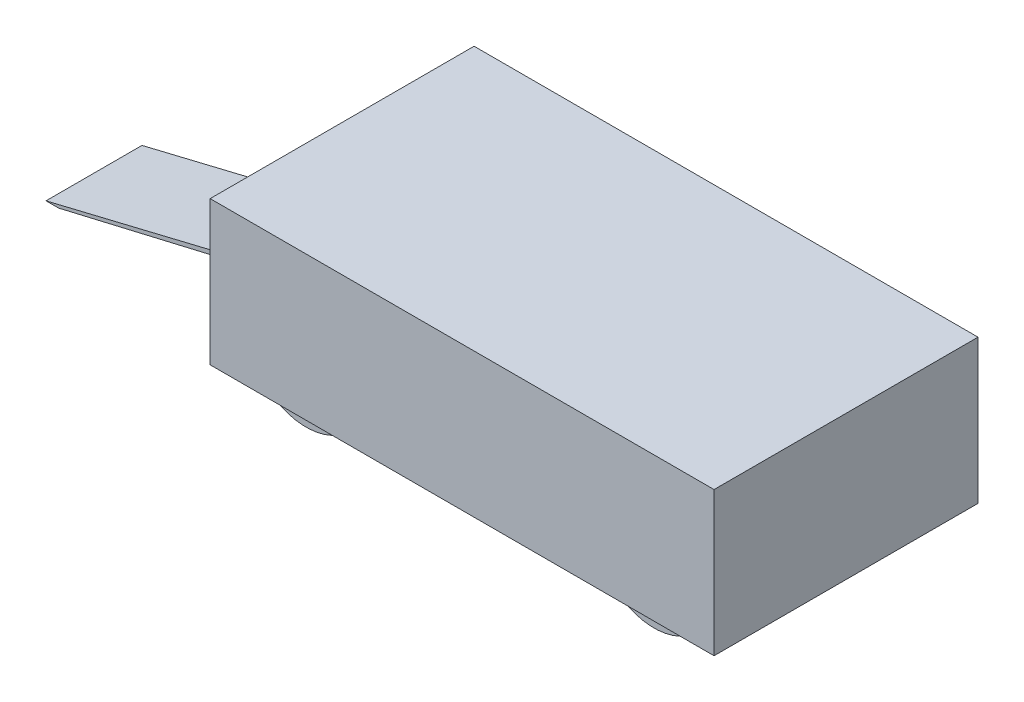
from build123d import *

# Parameters (mm, degrees)
CHASIS_W                = 533.4
CHASIS_H                = 279.4
BOSS_EXTRUDE1_DEPTH     = 152.4
SKETCH3_W               = 63.5
SKETCH3_H               = 50.8
MIRROR2_COPY_1_SKETCH_W = 63.5
MIRROR2_COPY_1_SKETCH_H = 50.8
SKETCH4_W               = 101.6
SKETCH4_H               = 12.7
CUT_EXTRUDE1_DEPTH      = 241.3
BOSS_EXTRUDE2_DEPTH     = 101.6


with BuildPart() as part:
    # Chasis → Boss-Extrude1 (new body)
    with BuildSketch(Plane(origin=(0, 0, 0), x_dir=(1, 0, 0), z_dir=(0, 1, 0))):
        Rectangle(CHASIS_W, CHASIS_H)
    extrude(amount=BOSS_EXTRUDE1_DEPTH)

    # Sketch3 → Revolve2 (revolve)
    with BuildSketch(Plane(origin=(0, 38.1, 0), x_dir=(-1, 0, 0), z_dir=(0, -1, 0))):
        with Locations((215.9, -95.25)):
            Rectangle(SKETCH3_W, SKETCH3_H)
    revolve2 = revolve(axis=Axis((-184.15, 38.1, 69.85), (0, 0, 1)))

    # Mirror1: Revolve2 across plane
    add(revolve2.mirror(Plane.XY))

    # Mirror2: Revolve2 across plane
    add(revolve2.mirror(Plane(origin=(0, 0, 0), x_dir=(0, 0, 1), z_dir=(1, 0, 0))))

    # Mirror2 copy 1 sketch → Mirror2 copy 1 (revolve)
    with BuildSketch(Plane.XZ.offset(-38.1)):
        with Locations((215.9, -95.25)):
            Rectangle(MIRROR2_COPY_1_SKETCH_W, MIRROR2_COPY_1_SKETCH_H)
    revolve(axis=Axis((184.15, 38.1, -69.85), (0, 0, -1)))

    # Sketch4 → Cut-Extrude1 (cut)
    with BuildSketch(Plane.ZY.offset(266.7)):
        with Locations((0, 44.45)):
            Rectangle(SKETCH4_W, SKETCH4_H)
    extrude(amount=-CUT_EXTRUDE1_DEPTH, mode=Mode.SUBTRACT)

    # Sketch7 → Boss-Extrude2 (add)
    with BuildSketch(Plane.XY.offset(-50.8)):
        Polygon((-266.7, 38.1), (-529.359422098, -25.4), (-515.991575795, -25.4), (-266.7, 33.027558643), align=None)
    extrude(amount=BOSS_EXTRUDE2_DEPTH)


solid = part.part
